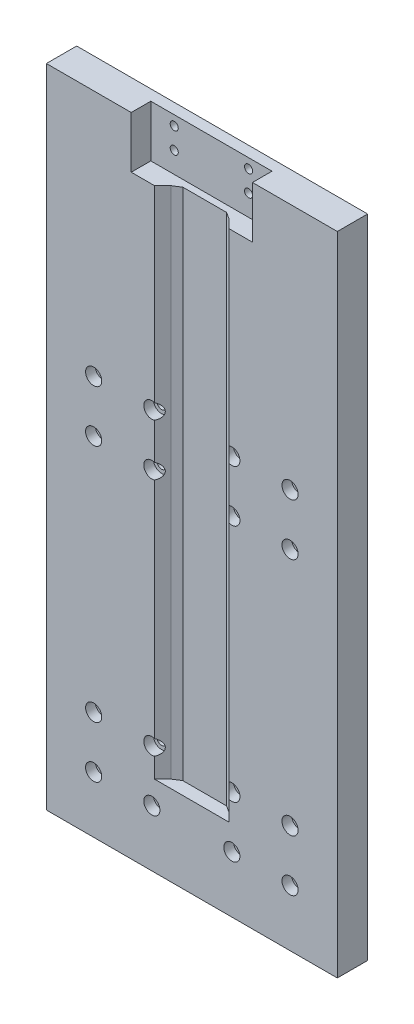
from build123d import *

# Parameters (mm, degrees)
BOSS_EXTRUDE1_DEPTH            = 18.75
CBORE_FOR_M5_SHCS2_D           = 5.5
CBORE_FOR_M5_SHCS2_CBORE_D     = 10
CBORE_FOR_M5_SHCS2_CBORE_DEPTH = 6
CUT_EXTRUDE1_DEPTH             = 350
CUT_EXTRUDE2_DEPTH             = 12.1
SKETCH30_R                     = 2.5
CUT_EXTRUDE3_DEPTH             = 252.935329003


with BuildPart() as part:
    # Sketch1 → Boss-Extrude1 (new body)
    with BuildSketch(Plane.XY):
        Polygon((90, 22), (90, -210), (90, -235), (-90, -235), (-90, 165), (90, 165), align=None)
    extrude(amount=BOSS_EXTRUDE1_DEPTH)

    # CBORE for M5 SHCS2 (through all)
    with Locations(Plane.XY.offset(18.75)):
        with Locations((-60.75, -200), (-60.75, -168), (-24.75, -168), (-24.75, -200), (24.75, -200), (24.75, -168), (60.75, -168), (60.75, -200), (-60.75, -20), (-60.75, 12), (-24.75, -20), (24.75, 12), (60.75, 12), (60.75, -20), (24.75, -20), (-24.75, 12)):
            CounterBoreHole(CBORE_FOR_M5_SHCS2_D / 2, CBORE_FOR_M5_SHCS2_CBORE_D / 2, CBORE_FOR_M5_SHCS2_CBORE_DEPTH)

    # Sketch28 → Cut-Extrude1 (cut)
    with BuildSketch(Plane(origin=(0, 165, 0), x_dir=(1, 0, 0), z_dir=(0, 1, 0))):
        Polygon((23.074976608, -18.75), (17.946938328, -13.621961721), (13.555789015, -10.796343736), (-13.555789015, -10.796343736), (-17.946938328, -13.621961721), (-23.074976608, -18.75), align=None)
    extrude(amount=-CUT_EXTRUDE1_DEPTH, mode=Mode.SUBTRACT)

    # Sketch29 → Cut-Extrude2 (cut)
    with BuildSketch(Plane.XY.offset(18.75)):
        Polygon((0, 165), (37.5, 165), (37.5, 133), (-37.5, 133), (-37.5, 165), align=None)
    extrude(amount=-CUT_EXTRUDE2_DEPTH, mode=Mode.SUBTRACT)

    # Sketch30 → Cut-Extrude3 (cut, through all)
    with BuildSketch(Plane.XY.offset(6.65)):
        with Locations((23, 159)):
            Circle(SKETCH30_R)
        with Locations((-23, 159)):
            Circle(SKETCH30_R)
        with Locations((23, 146)):
            Circle(SKETCH30_R)
        with Locations((-23, 146)):
            Circle(SKETCH30_R)
    extrude(amount=-CUT_EXTRUDE3_DEPTH, mode=Mode.SUBTRACT)


solid = part.part
